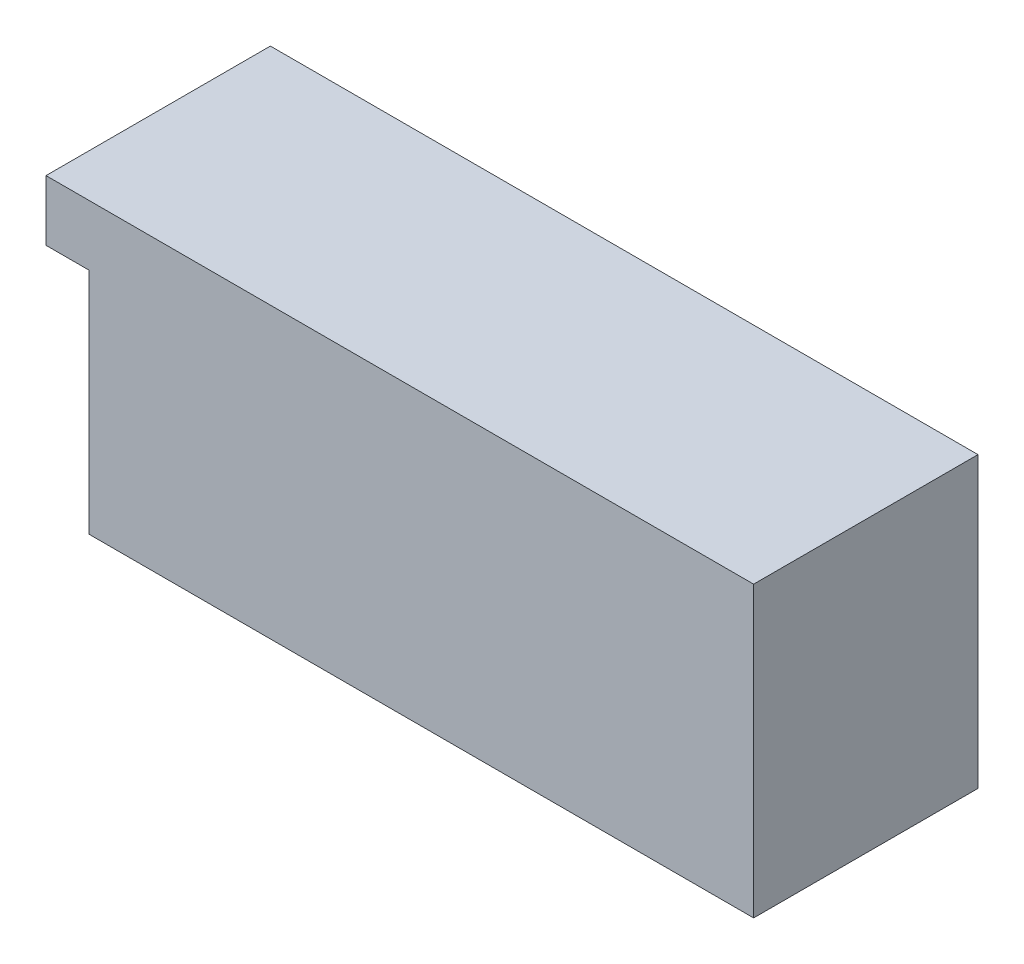
from build123d import *

# Parameters (mm, degrees)
SKETCH2_W           = 77
SKETCH2_H           = 33.5
BOSS_EXTRUDE1_DEPTH = 26
SKETCH3_W           = 26
SKETCH3_H           = 7
BOSS_EXTRUDE2_DEPTH = 5


with BuildPart() as part:
    # Sketch2 → Boss-Extrude1 (new body)
    with BuildSketch(Plane.XY):
        Rectangle(SKETCH2_W, SKETCH2_H)
    extrude(amount=BOSS_EXTRUDE1_DEPTH)

    # Sketch3 → Boss-Extrude2 (add)
    with BuildSketch(Plane.ZY.offset(38.5)):
        with Locations((13, 13.25)):
            Rectangle(SKETCH3_W, SKETCH3_H)
    extrude(amount=BOSS_EXTRUDE2_DEPTH)


solid = part.part
